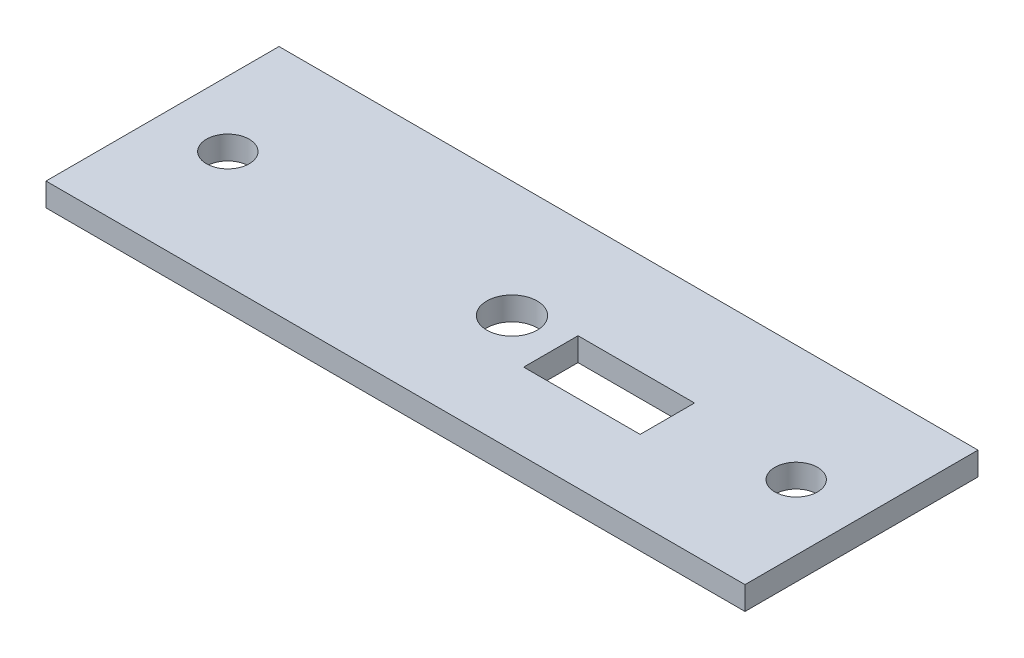
from build123d import *

# Parameters (mm, degrees)
SKETCH_1_W      = 90
SKETCH_1_H      = 30
SKETCH_1_R      = 2.75
EXTRUDE_1_DEPTH = 3


with BuildPart() as part:
    # 草圖1 → 填料-伸長1 (new body)
    with BuildSketch(Plane(origin=(0, 0, 0), x_dir=(1, 0, 0), z_dir=(0, 1, 0))):
        Rectangle(SKETCH_1_W, SKETCH_1_H)
        Polygon((6.5, -5), (6.5, 0), (6.5, 2), (21.5, 2), (21.5, 0), (21.5, -5), align=None, mode=Mode.SUBTRACT)
        with Locations((-36.59, 0)):
            Circle(SKETCH_1_R, mode=Mode.SUBTRACT)
        with BuildLine():
            ThreePointArc((3.25, 0), (0, -3.25), (-3.25, 0))
            ThreePointArc((-3.25, 0), (0, 3.25), (3.25, 0))
        make_face(mode=Mode.SUBTRACT)
        with BuildLine():
            ThreePointArc((39.34, 0), (36.59, -2.75), (33.84, 0))
            ThreePointArc((33.84, 0), (36.59, 2.75), (39.34, 0))
        make_face(mode=Mode.SUBTRACT)
    extrude(amount=EXTRUDE_1_DEPTH)


solid = part.part
